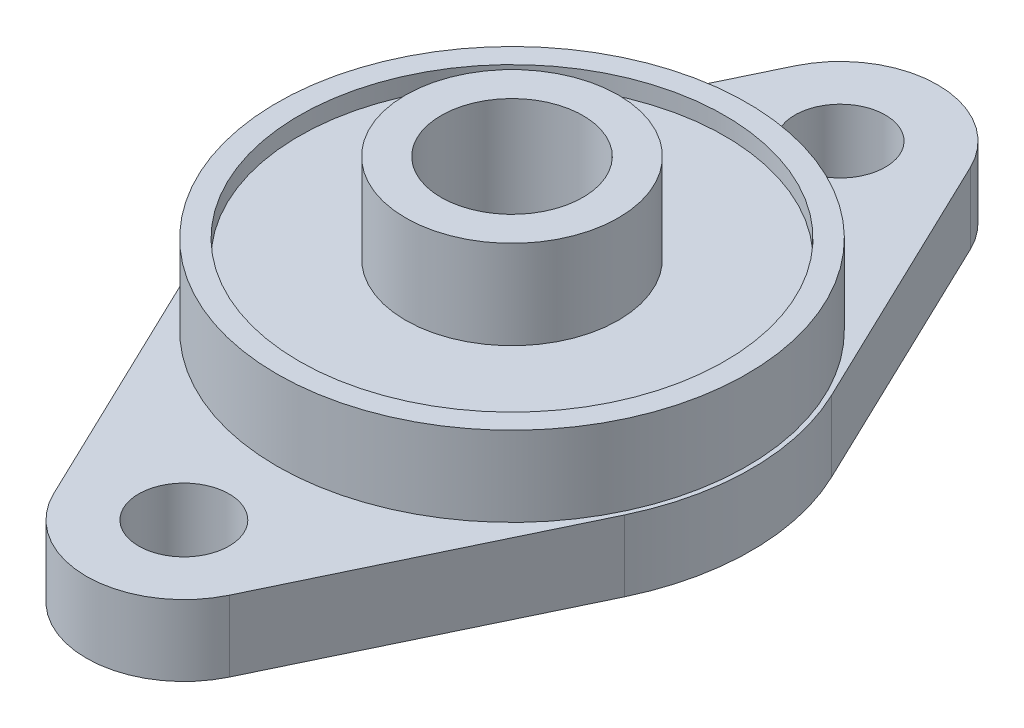
from build123d import *

# Parameters (mm, degrees)
SKETCH1_R           = 2.55
BOSS_EXTRUDE1_DEPTH = 4
SKETCH2_R           = 13.25
BOSS_EXTRUDE2_DEPTH = 4.5
SKETCH3_R           = 12
CUT_EXTRUDE1_DEPTH  = 1
SKETCH4_R           = 6
BOSS_EXTRUDE3_DEPTH = 5
SKETCH5_R           = 4
CUT_EXTRUDE2_DEPTH  = 31.24070105


with BuildPart() as part:
    # Sketch1 → Boss-Extrude1 (new body)
    with BuildSketch(Plane(origin=(0, 0, 0), x_dir=(1, 0, 0), z_dir=(0, 1, 0))):
        with BuildLine():
            Line((4.959164878, 20.878378378), (12.17249561, 5.837837838))
            ThreePointArc((12.17249561, 5.837837838), (13.5, 0), (12.17249561, -5.837837838))
            Line((12.17249561, -5.837837838), (4.959164878, -20.878378378))
            ThreePointArc((4.959164878, -20.878378378), (0, -24), (-4.959164878, -20.878378378))
            Line((-4.959164878, -20.878378378), (-12.17249561, -5.837837838))
            ThreePointArc((-12.17249561, -5.837837838), (-13.5, 0), (-12.17249561, 5.837837838))
            Line((-12.17249561, 5.837837838), (-4.959164878, 20.878378378))
            ThreePointArc((-4.959164878, 20.878378378), (0, 24), (4.959164878, 20.878378378))
        make_face()
        with Locations(Location((0, 18.5, 0), (0, 0, 270))):
            Circle(SKETCH1_R, mode=Mode.SUBTRACT)
        with Locations(Location((0, -18.5, 0), (0, 0, 270))):
            Circle(SKETCH1_R, mode=Mode.SUBTRACT)
    extrude(amount=BOSS_EXTRUDE1_DEPTH)

    # Sketch2 → Boss-Extrude2 (add)
    with BuildSketch(Plane(origin=(0, 4, 0), x_dir=(1, 0, 0), z_dir=(0, 1, 0))):
        with Locations(Location((0, 0, 0), (0, 0, 270))):
            Circle(SKETCH2_R)
    extrude(amount=BOSS_EXTRUDE2_DEPTH)

    # Sketch3 → Cut-Extrude1 (cut)
    with BuildSketch(Plane(origin=(0, 8.5, 0), x_dir=(1, 0, 0), z_dir=(0, 1, 0))):
        with Locations(Location((0, 0, 0), (0, 0, 270))):
            Circle(SKETCH3_R)
    extrude(amount=-CUT_EXTRUDE1_DEPTH, mode=Mode.SUBTRACT)

    # Sketch4 → Boss-Extrude3 (add)
    with BuildSketch(Plane(origin=(0, 7.5, 0), x_dir=(1, 0, 0), z_dir=(0, 1, 0))):
        with Locations(Location((0, 0, 0), (0, 0, 270))):
            Circle(SKETCH4_R)
    extrude(amount=BOSS_EXTRUDE3_DEPTH)

    # Sketch5 → Cut-Extrude2 (cut, through all)
    with BuildSketch(Plane(origin=(0, 12.5, 0), x_dir=(1, 0, 0), z_dir=(0, 1, 0))):
        with Locations(Location((0, 0, 0), (0, 0, 270))):
            Circle(SKETCH5_R)
    extrude(amount=-CUT_EXTRUDE2_DEPTH, mode=Mode.SUBTRACT)


solid = part.part
